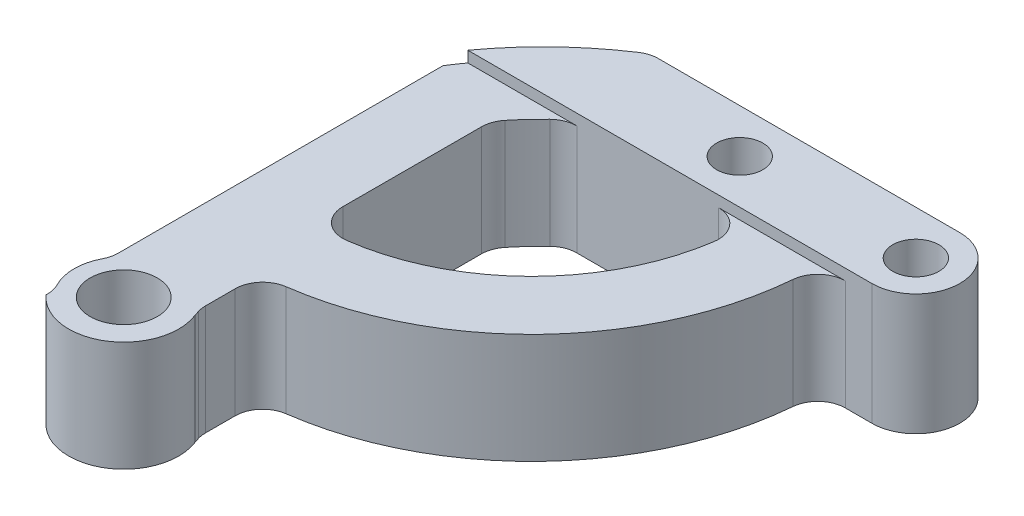
from build123d import *

# Parameters (mm, degrees)
SKETCH1_R           = 2.1
SKETCH1_R_2         = 3.05
BOSS_EXTRUDE1_DEPTH = 11
FILLET1_R           = 2.5
SKETCH2_W           = 62.859905726
SKETCH2_H           = 67.127049317
CUT_EXTRUDE1_DEPTH  = 1


with BuildPart() as part:
    # Sketch1 → Boss-Extrude1 (new body)
    with BuildSketch(Plane(origin=(0, 0, 0), x_dir=(1, 0, 0), z_dir=(0, 1, 0))):
        with BuildLine():
            Line((-141.618033146, -48.413320241), (-141.618033146, -47.605254623))
            ThreePointArc((-141.618033146, -47.605254623), (-142.400057305, -45.070169685), (-141.618033146, -42.535084747))
            Line((-141.618033146, -42.535084747), (-141.618033146, -12.337550143))
            ThreePointArc((-141.618033146, -12.337550143), (-137.391034255, -7.146662711), (-132.135747469, -3.000002276))
            Line((-132.135747469, -3.000002276), (-103.999998533, -3.000002276))
            ThreePointArc((-103.999998533, -3.000002276), (-99.999998533, -7.000002276), (-103.999998533, -11.000002276))
            Line((-103.999998533, -11.000002276), (-108.800450096, -11.000002276))
            ThreePointArc((-108.800450096, -11.000002276), (-115.958524417, -28.957739522), (-133.507162881, -37.067218112))
            Line((-133.507162881, -37.067218112), (-133.507162881, -42.428250309))
            ThreePointArc((-133.507162881, -42.428250309), (-133.376053416, -42.838619725), (-133.243682576, -43.248584005))
            ThreePointArc((-133.243682576, -43.248584005), (-135.275410049, -49.325898387), (-141.618033146, -48.413320241))
        make_face()
        with Locations(Location((-103.999998533, -7.000002276, 0), (0, 0, 270))):
            Circle(SKETCH1_R, mode=Mode.SUBTRACT)
        with Locations(Location((-120, -7, 0), (0, 0, 270))):
            Circle(SKETCH1_R, mode=Mode.SUBTRACT)
        with Locations(Location((-137.900057305, -45.070169685, 0), (0, 0, 270))):
            Circle(SKETCH1_R_2, mode=Mode.SUBTRACT)
        with BuildLine():
            Line((-115.253720534, -10.999999988), (-131.784308175, -10.999999988))
            ThreePointArc((-131.784308175, -10.999999988), (-133.51136611, -12.688858333), (-135.059388528, -14.543204098))
            Line((-135.059388528, -14.543204098), (-135.076749083, -30.65065719))
            ThreePointArc((-135.076749083, -30.65065719), (-121.070294848, -24.956188484), (-115.253720534, -10.999999988))
        make_face(mode=Mode.SUBTRACT)
    extrude(amount=BOSS_EXTRUDE1_DEPTH)

    # Fillet1
    fillet1_edges = [part.edges().sort_by_distance(p)[0] for p in [
        (-141.618033146, 5.5, 42.535084747),
        (-132.135747469, 5.5, 3.000002276),
        (-108.800450096, 5.5, 11.000002276),
        (-133.507162881, 5.5, 37.067218112),
        (-133.507162881, 5.5, 42.428250309),
        (-133.243682576, 5.5, 43.248584005),
        (-141.618033146, 5.5, 47.605254623),
        (-135.076749083, 5.5, 30.65065719),
        (-115.253720534, 5.5, 10.999999988),
        (-131.784308175, 5.5, 10.999999988),
        (-135.059388528, 5.5, 14.543204098),
    ]]
    fillet(fillet1_edges, radius=FILLET1_R)

    # Sketch2 → Cut-Extrude1 (cut)
    with BuildSketch(Plane(origin=(0, 11, 0), x_dir=(1, 0, 0), z_dir=(0, 1, 0))):
        with Locations((-133.229918527, -44.563526935)):
            Rectangle(SKETCH2_W, SKETCH2_H)
    extrude(amount=-CUT_EXTRUDE1_DEPTH, mode=Mode.SUBTRACT)


solid = part.part
